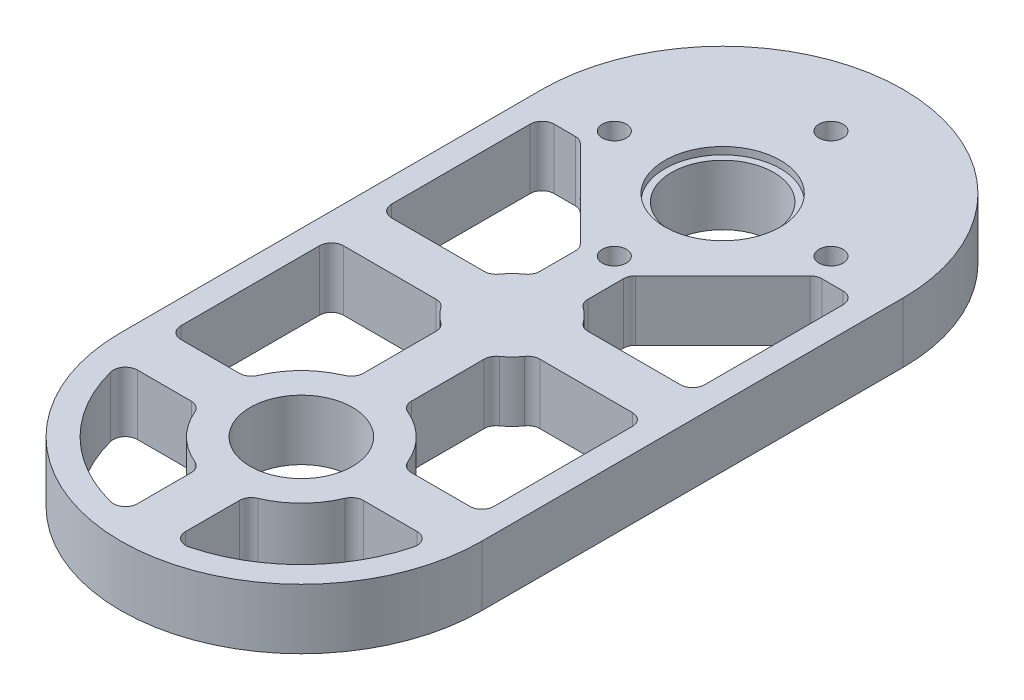
from build123d import *

# Parameters (mm, degrees)
SKETCH_1_R             = 4
SKETCH_1_R_2           = 2
EXTRUDE_1_DEPTH        = 10
SKETCH_2_R             = 8.5
CUT_EXTRUDE_1_DEPTH    = 10
SKETCH_4_R             = 2.5
CUT_EXTRUDE_3_DEPTH    = 30
CUT_EXTRUDE_8_DEPTH    = 10
FILLET_1_R             = 2
FILLET_1_OF_MIRROR_1_R = 2
SKETCH_11_R            = 2.5
EXTRUDE_2_DEPTH        = 10
SKETCH_12_R            = 8.5
CUT_EXTRUDE_10_DEPTH   = 21
SKETCH_13_R            = 9.6
CUT_EXTRUDE_11_DEPTH   = 1.2
EXTRUDE_START          = 1.2
SKETCH_14_R            = 12
SKETCH_14_R_2          = 8.5
EXTRUDE_3_DEPTH        = 1.2


with BuildPart() as part:
    # 草图1 → 凸台-拉伸1 (new body)
    with BuildSketch(Plane(origin=(0, 0, 0), x_dir=(1, 0, 0), z_dir=(0, 1, 0))):
        with BuildLine():
            Line((30, 0), (30, -70.000015024))
            ThreePointArc((30, -70.000015024), (-7.512e-06, -100.000015025), (-30, -70))
            Line((-30, -70), (-30, 0))
            ThreePointArc((-30, 0), (0, 30), (30, 0))
        make_face()
        with Locations(Location((0, 0, 0), (0, 0, 270))):
            Circle(SKETCH_1_R, mode=Mode.SUBTRACT)
        with Locations(Location((0, 18, 0), (0, 0, 270))):
            Circle(SKETCH_1_R_2, mode=Mode.SUBTRACT)
        with Locations(Location((18, 0, 0), (0, 0, 270))):
            Circle(SKETCH_1_R_2, mode=Mode.SUBTRACT)
        with Locations(Location((0, -18, 0), (0, 0, 270))):
            Circle(SKETCH_1_R_2, mode=Mode.SUBTRACT)
        with Locations(Location((-18, 0, 0), (0, 0, 270))):
            Circle(SKETCH_1_R_2, mode=Mode.SUBTRACT)
    extrude(amount=EXTRUDE_1_DEPTH)

    # 草图2 → 切除-拉伸1 (cut)
    with BuildSketch(Plane(origin=(0, 10, 0), x_dir=(1, 0, 0), z_dir=(0, 1, 0))):
        with Locations(Location((0, -70.000015025, 0), (0, 0, 270))):
            Circle(SKETCH_2_R)
    extrude(amount=-CUT_EXTRUDE_1_DEPTH, mode=Mode.SUBTRACT)

    # 草图4 → 切除-拉伸3 (cut)
    with BuildSketch(Plane.XZ):
        with Locations(Location((0, 35.000007512, 0), (0, 0, 270))):
            Circle(SKETCH_4_R)
    extrude(amount=-CUT_EXTRUDE_3_DEPTH, mode=Mode.SUBTRACT)

    # 草图9 → 切除-拉伸8 (cut)
    with BuildSketch(Plane(origin=(0, 0, 0), x_dir=(-1, 0, 0), z_dir=(0, -1, 0))):
        with BuildLine():
            Line((7.5, -31.000007512), (26, -31.000007512))
            Line((26, -31.000007512), (26, -4))
            Line((26, -4), (19.656854249, -4))
            Line((19.656854249, -4), (4, -19.656854249))
            Line((4, -19.656854249), (4, -27.500007512))
            ThreePointArc((4, -27.500007512), (6.01040764, -28.989599872), (7.5, -31.000007512))
        make_face()
        with BuildLine():
            Line((12.893794955, -66.000008567), (26, -66.000002003))
            Line((26, -66.000002003), (26, -39.000007512))
            Line((26, -39.000007512), (7.5, -39.000007512))
            ThreePointArc((7.5, -39.000007512), (6.01040764, -41.010415152), (4, -42.500007512))
            Line((4, -42.500007512), (4, -57.106218067))
            ThreePointArc((4, -57.106218067), (9.545939156, -60.454071088), (12.893794955, -66.000008567))
        make_face()
        with BuildLine():
            Line((12.893798962, -74.000008567), (25.690467161, -74.000002158))
            ThreePointArc((25.690467161, -74.000002158), (18.384780915, -88.384786732), (4, -95.690480182))
            Line((4, -95.690480182), (4, -82.893811983))
            ThreePointArc((4, -82.893811983), (9.545943936, -79.54595418), (12.893798962, -74.000008567))
        make_face()
    cut_extrude_8 = extrude(amount=-CUT_EXTRUDE_8_DEPTH, mode=Mode.SUBTRACT)

    # 圆角1
    fillet_1_edges = [part.edges().sort_by_distance(p)[0] for p in [
        (-26, 5, 4),
        (-26, 5, 31.000007512),
        (-7.5, 5, 31.000007512),
        (-4, 5, 27.500007512),
        (-4, 5, 19.656854249),
        (-19.656854249, 5, 4),
        (-4, 5, 42.500007512),
        (-7.5, 5, 39.000007512),
        (-26, 5, 39.000007512),
        (-26, 5, 66.000002003),
        (-12.893794955, 5, 66.000008567),
        (-4, 5, 57.106218067),
        (-25.690467161, 5, 74.000002158),
        (-4, 5, 95.690480182),
        (-4, 5, 82.893811983),
        (-12.893798962, 5, 74.000008567),
    ]]
    fillet(fillet_1_edges, radius=FILLET_1_R)

    # 镜向1: 切除-拉伸8 across plane
    add(cut_extrude_8.mirror(Plane.ZY), mode=Mode.SUBTRACT)

    # 圆角1 of 镜向1
    fillet_1_of_mirror_1_edges = [part.edges().sort_by_distance(p)[0] for p in [
        (26, 5, 4),
        (26, 5, 31.000007512),
        (7.5, 5, 31.000007512),
        (4, 5, 27.500007512),
        (4, 5, 19.656854249),
        (19.656854249, 5, 4),
        (4, 5, 42.500007512),
        (7.5, 5, 39.000007512),
        (26, 5, 39.000007512),
        (26, 5, 66.000002003),
        (12.893794955, 5, 66.000008567),
        (4, 5, 57.106218067),
        (25.690467161, 5, 74.000002158),
        (4, 5, 95.690480182),
        (4, 5, 82.893811983),
        (12.893798962, 5, 74.000008567),
    ]]
    fillet(fillet_1_of_mirror_1_edges, radius=FILLET_1_OF_MIRROR_1_R)

    # 草图11 → 凸台-拉伸2 (add)
    with BuildSketch(Plane(origin=(0, 0, 0), x_dir=(-1, 0, 0), z_dir=(0, -1, 0))):
        with Locations((0, -35.000007512)):
            Circle(SKETCH_11_R)
    extrude(amount=-EXTRUDE_2_DEPTH)

    # 草图12 → 切除-拉伸10 (cut)
    with BuildSketch(Plane(origin=(0, 0, 0), x_dir=(-1, 0, 0), z_dir=(0, -1, 0))):
        with Locations(Location((0, 0, 0), (0, 0, 90))):
            Circle(SKETCH_12_R)
    extrude(amount=-CUT_EXTRUDE_10_DEPTH, mode=Mode.SUBTRACT)

    # 草图13 → 切除-拉伸11 (cut)
    with BuildSketch(Plane(origin=(0, 10, 0), x_dir=(1, 0, 0), z_dir=(0, 1, 0))):
        with Locations(Location((0, 0, 0), (0, 0, 270))):
            Circle(SKETCH_13_R)
    extrude(amount=-CUT_EXTRUDE_11_DEPTH, mode=Mode.SUBTRACT)

    # 草图14 → 凸台-拉伸3 (add)
    with BuildSketch(Plane(origin=(0, 0, 0), x_dir=(-1, 0, 0), z_dir=(0, -1, 0)).offset(EXTRUDE_START)):
        with Locations(Location((0, 0, 0), (0, 0, 270))):
            Circle(SKETCH_14_R)
        with Locations(Location((0, 0, 0), (0, 0, 90))):
            Circle(SKETCH_14_R_2, mode=Mode.SUBTRACT)
    extrude(amount=-EXTRUDE_3_DEPTH)


solid = part.part
